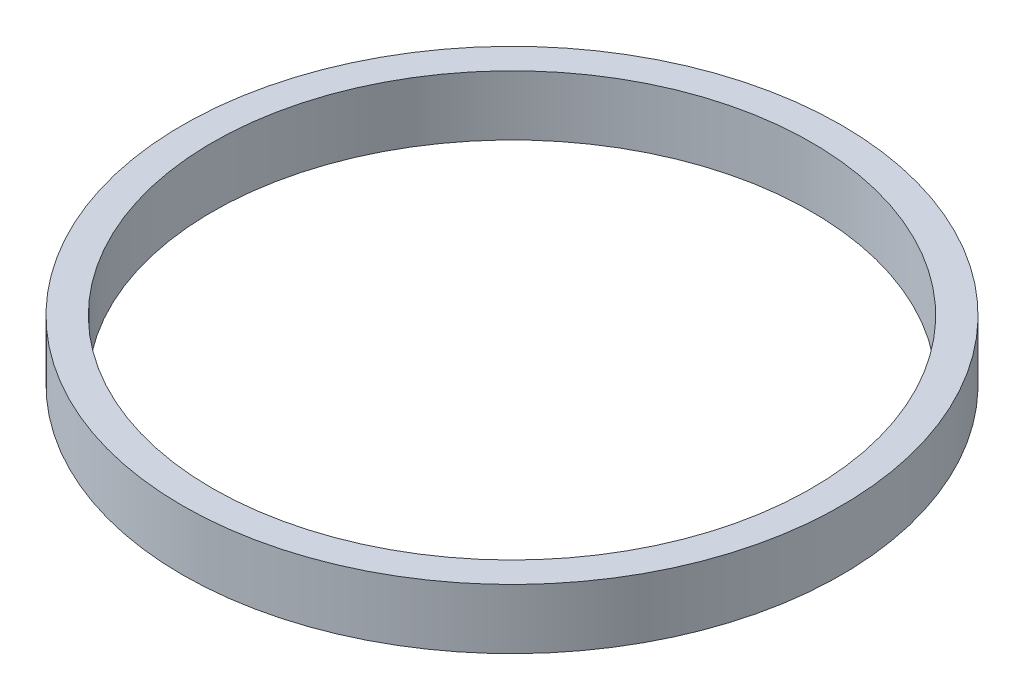
from build123d import *

# Parameters (mm, degrees)
SKETCH_1_R      = 16.5
SKETCH_1_R_2    = 15
EXTRUDE_1_DEPTH = 3


with BuildPart() as part:
    # Эскиз1 → Бобышка-Вытянуть1 (new body)
    with BuildSketch(Plane(origin=(0, 0, 0), x_dir=(1, 0, 0), z_dir=(0, 1, 0))):
        with Locations(Location((0, 0, 0), (0, 0, 270))):
            Circle(SKETCH_1_R)
        with Locations(Location((0, 0, 0), (0, 0, 270))):
            Circle(SKETCH_1_R_2, mode=Mode.SUBTRACT)
    extrude(amount=EXTRUDE_1_DEPTH)


solid = part.part
